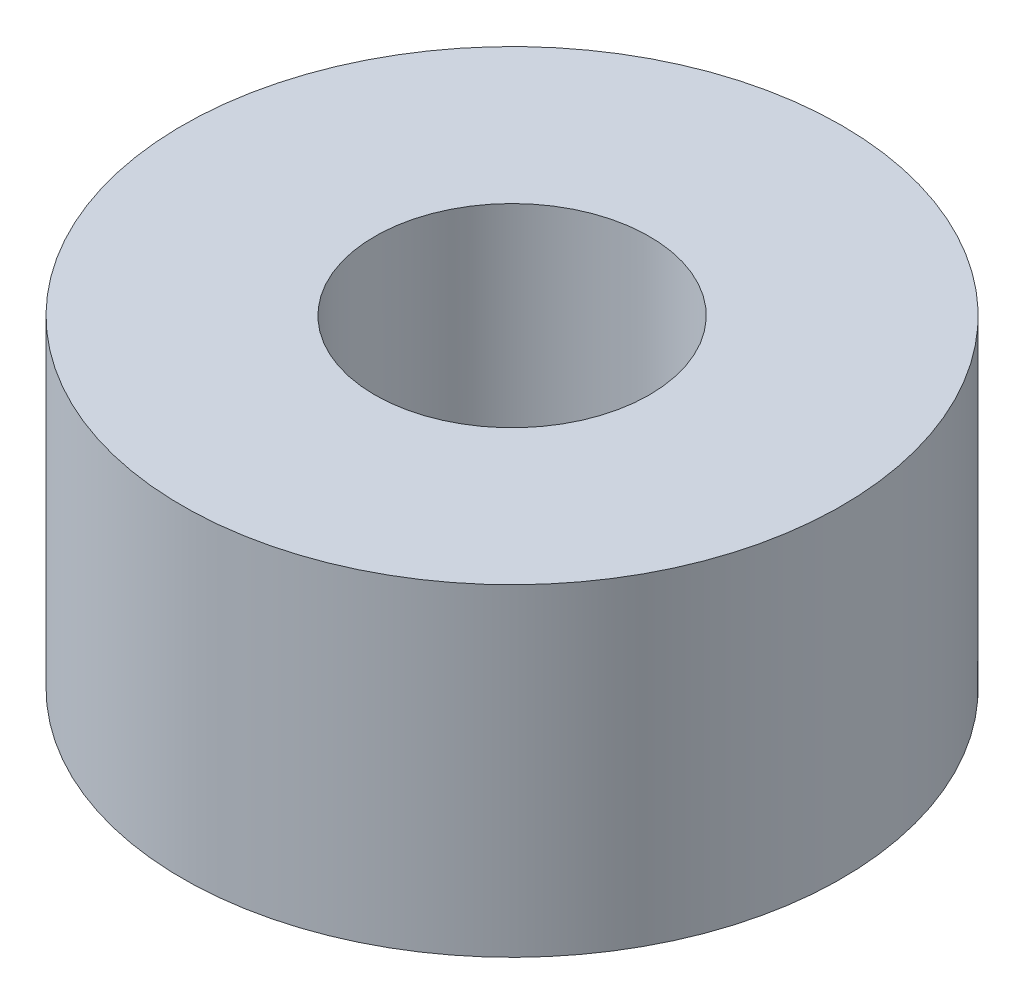
from build123d import *

# Parameters (mm, degrees)
SKETCH_2_R          = 2
CUT_EXTRUDE_1_DEPTH = 10


with BuildPart() as part:
    # 草图1 → 旋转1 (revolve)
    with BuildSketch(Plane.XY, mode=Mode.PRIVATE) as revolve_1_sk:
        Polygon((0, 5.2), (4.8, 5.2), (4.8, 0.5), (2.8, 0), (0, 0), align=None)
    revolve(revolve_1_sk.sketch.rotate(Axis((0, 0, 0), (0, 1, 0)), 90), axis=Axis((0, 0, 0), (0, 1, 0)))

    # 草图2 → 切除-拉伸1 (cut)
    with BuildSketch(Plane.XZ):
        Circle(SKETCH_2_R)
    extrude(amount=-CUT_EXTRUDE_1_DEPTH, mode=Mode.SUBTRACT)


solid = part.part
